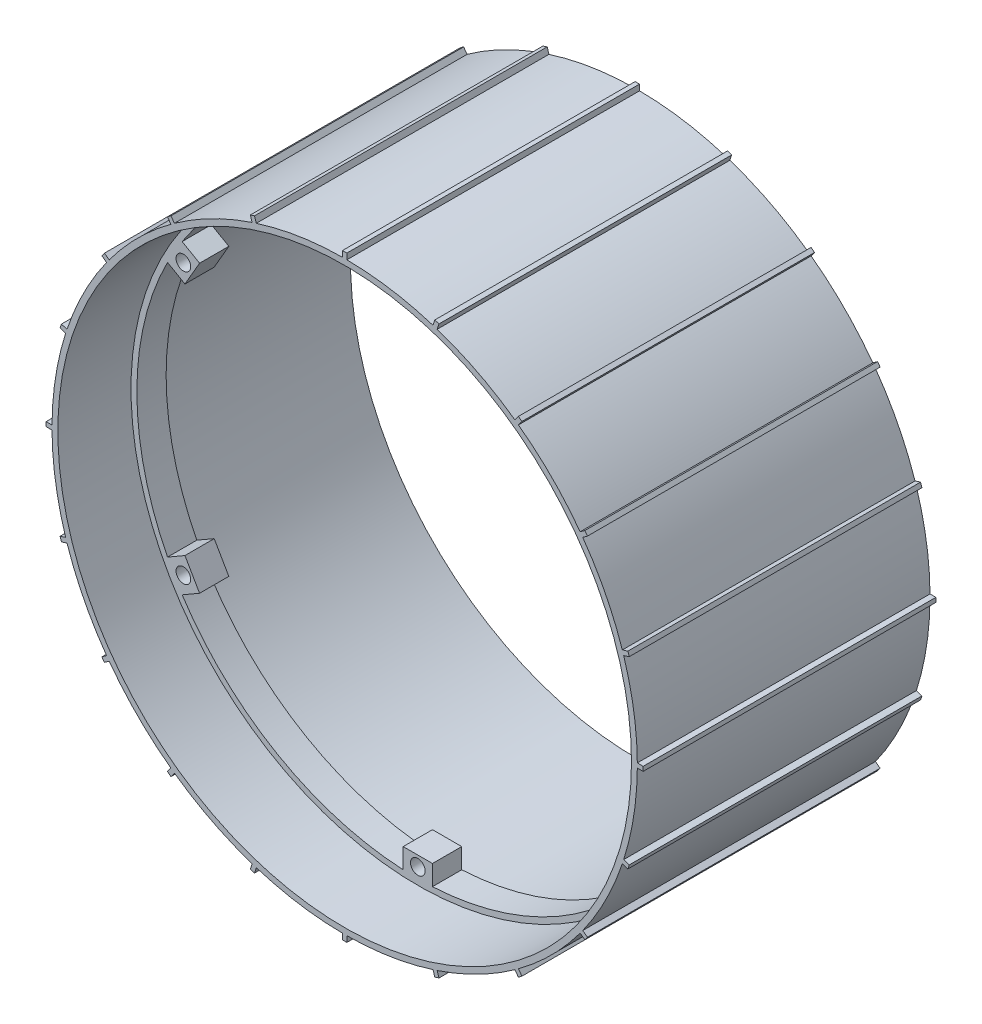
from build123d import *

# Parameters (mm, degrees)
SKETCH2_R           = 100
SKETCH2_R_2         = 98
BOSS_EXTRUDE2_DEPTH = 50
BOSS_EXTRUDE3_DEPTH = 50
CIRPATTERN1_COUNT   = 20
SKETCH7_R           = 98
SKETCH7_R_2         = 96
BOSS_EXTRUDE5_DEPTH = 5
SKETCH14_W          = 10
SKETCH14_H          = 7
BOSS_EXTRUDE8_DEPTH = 10
SKETCH15_R          = 2.5
CUT_EXTRUDE3_DEPTH  = 10
CIRPATTERN6_COUNT   = 6


with BuildPart() as part:
    # Sketch2 → Boss-Extrude2 (new, symmetric)
    with BuildSketch(Plane.XY):
        Circle(SKETCH2_R)
        Circle(SKETCH2_R_2, mode=Mode.SUBTRACT)
    extrude(amount=BOSS_EXTRUDE2_DEPTH, both=True)

    # Sketch4 → Boss-Extrude3 (add, symmetric)
    with BuildSketch(Plane.XY):
        Polygon((0, 101.99718746), (-0.75, 101.99718746), (-0.75, 99.99718746), (0.75, 99.99718746), (0.75, 101.99718746), align=None)
    boss_extrude3 = extrude(amount=BOSS_EXTRUDE3_DEPTH, both=True)

    # CirPattern1: Boss-Extrude3 ×20 about axis
    cirpattern1_axis = Axis((0, 0, 0), (0, 0, 1))
    for i in range(1, CIRPATTERN1_COUNT):
        add(boss_extrude3.rotate(cirpattern1_axis, i * 360 / CIRPATTERN1_COUNT))

    # Sketch7 → Boss-Extrude5 (add, symmetric)
    with BuildSketch(Plane.XY.offset(20)):
        Circle(SKETCH7_R)
        Circle(SKETCH7_R_2, mode=Mode.SUBTRACT)
    extrude(amount=BOSS_EXTRUDE5_DEPTH, both=True)

    # Sketch14 → Boss-Extrude8 (add)
    with BuildSketch(Plane.XY.offset(25)):
        with Locations((0, 92.5)):
            Rectangle(SKETCH14_W, SKETCH14_H)
    boss_extrude8 = extrude(amount=-BOSS_EXTRUDE8_DEPTH)

    # Sketch15 → Cut-Extrude3 (cut)
    with BuildSketch(Plane.XY.offset(25)):
        with Locations((0, 92.5)):
            Circle(SKETCH15_R)
    cut_extrude3 = extrude(amount=-CUT_EXTRUDE3_DEPTH, mode=Mode.SUBTRACT)

    # CirPattern6: Boss-Extrude8, Cut-Extrude3 ×6 about axis
    cirpattern6_axis = Axis((0, 0, 0), (0, 0, 1))
    add([boss_extrude8.rotate(cirpattern6_axis, i * 360 / CIRPATTERN6_COUNT) for i in range(1, CIRPATTERN6_COUNT)])
    add([cut_extrude3.rotate(cirpattern6_axis, i * 360 / CIRPATTERN6_COUNT) for i in range(1, CIRPATTERN6_COUNT)], mode=Mode.SUBTRACT)


solid = part.part
